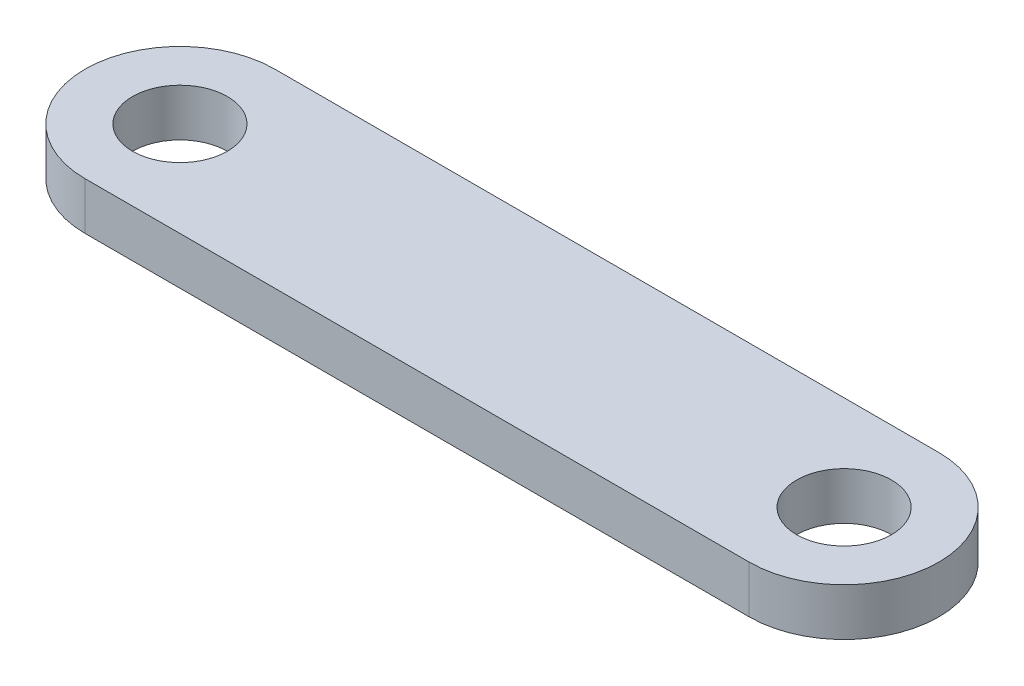
from build123d import *

# Parameters (mm, degrees)
SKETCH1_R           = 5
BOSS_EXTRUDE1_DEPTH = 5


with BuildPart() as part:
    # Sketch1 → Boss-Extrude1 (new body)
    with BuildSketch(Plane(origin=(0, 0, 0), x_dir=(1, 0, 0), z_dir=(0, 1, 0))):
        with BuildLine():
            Line((-35, 10), (35, 10))
            ThreePointArc((35, 10), (45, 0), (35, -10))
            Line((35, -10), (-35, -10))
            ThreePointArc((-35, -10), (-45, 0), (-35, 10))
        make_face()
        with Locations(Location((-35, 0, 0), (0, 0, 270))):
            Circle(SKETCH1_R, mode=Mode.SUBTRACT)
        with Locations(Location((35, 0, 0), (0, 0, 270))):
            Circle(SKETCH1_R, mode=Mode.SUBTRACT)
    extrude(amount=BOSS_EXTRUDE1_DEPTH)


solid = part.part
